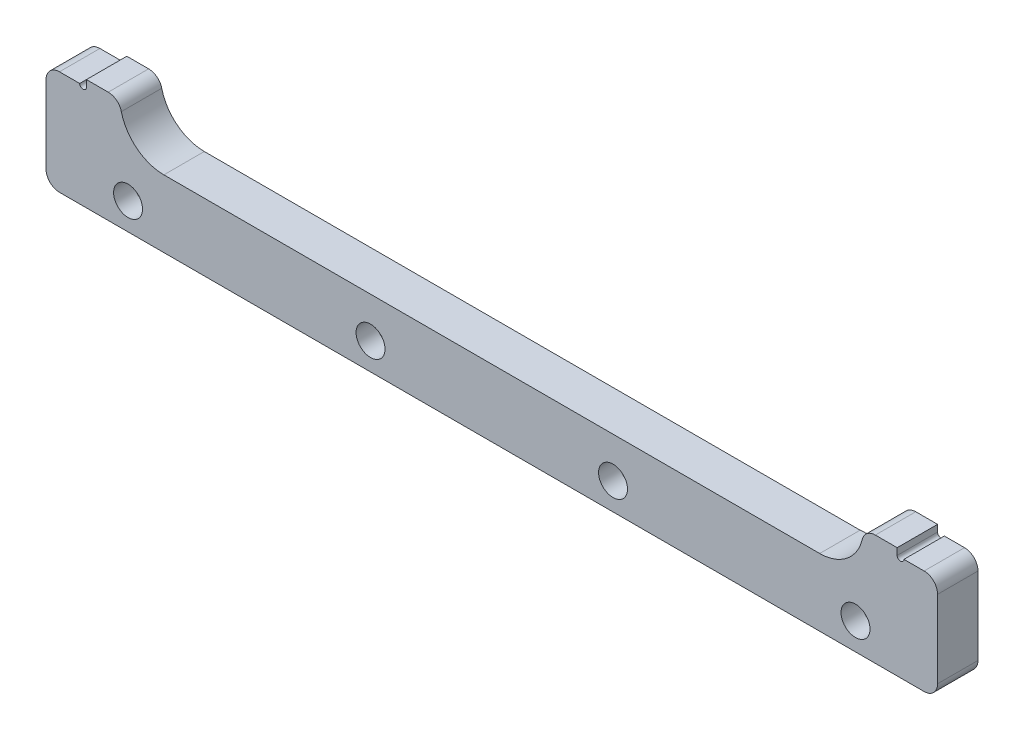
from build123d import *

# Parameters (mm, degrees)
EXTRUDE_1_DEPTH     = 6
CUT_EXTRUDE_START   = -6
CUT_EXTRUDE_1_DEPTH = 1
CUT_EXTRUDE_3_DEPTH = 3
SKETCH_5_OUTSIDE_W  = 281.366
SKETCH_5_OUTSIDE_H  = 83.498
CUT_EXTRUDE_2_DEPTH = 124.858535656
HOLE_WIZARD_M4_1_D  = 4.3
FILLET_3_R          = 2


with BuildPart() as part:
    # ｽｹｯﾁ1 → ﾎﾞｽ - 押し出し1 (new body)
    with BuildSketch(Plane.XY):
        with BuildLine():
            Line((-74.445215618, -8), (-65.183849372, -8))
            ThreePointArc((-65.183849372, -8), (-59.472431605, -21.788582233), (-45.683849372, -27.5))
            Line((-45.683849372, -27.5), (45.683849372, -27.5))
            ThreePointArc((45.683849372, -27.5), (59.472431605, -21.788582233), (65.183849372, -8))
            Line((65.183849372, -8), (74.445215618, -8))
            ThreePointArc((74.445215618, -8), (83.886790831, -21.023796042), (99.183849372, -26))
            Line((99.183849372, -26), (116.183849372, -26))
            Line((116.183849372, -26), (116.183849372, -34))
            Line((116.183849372, -34), (66.183849372, -42.5))
            Line((66.183849372, -42.5), (-66.183849372, -42.5))
            Line((-66.183849372, -42.5), (-116.183849372, -34))
            Line((-116.183849372, -34), (-116.183849372, -26))
            Line((-116.183849372, -26), (-99.183849372, -26))
            ThreePointArc((-99.183849372, -26), (-83.886790831, -21.023796042), (-74.445215618, -8))
        make_face()
    extrude(amount=-EXTRUDE_1_DEPTH)

    # ｽｹｯﾁ1<5> → ｶｯﾄ - 押し出し1 (cut)
    with BuildSketch(Plane.XY.offset(CUT_EXTRUDE_START)):
        with BuildLine():
            Line((-66.183849372, -8), (-72.183849372, -8))
            Line((-72.183849372, -8), (-72.183849372, -27))
            Line((-72.183849372, -27), (-116.183849372, -27))
            Line((-116.183849372, -27), (-116.183849372, -33))
            Line((-116.183849372, -33), (-72.183849372, -33))
            Line((-72.183849372, -33), (-72.183849372, -34))
            ThreePointArc((-72.183849372, -34), (-71.183849372, -35), (-70.183849372, -34))
            Line((-70.183849372, -34), (-68.183849372, -34))
            ThreePointArc((-68.183849372, -34), (-67.183849372, -35), (-66.183849372, -34))
            Line((-66.183849372, -34), (-66.183849372, -8))
        make_face()
        with BuildLine():
            Line((72.183849372, -8), (66.183849372, -8))
            Line((66.183849372, -8), (66.183849372, -34))
            ThreePointArc((66.183849372, -34), (67.183849372, -35), (68.183849372, -34))
            Line((68.183849372, -34), (70.183849372, -34))
            ThreePointArc((70.183849372, -34), (71.183849372, -35), (72.183849372, -34))
            Line((72.183849372, -34), (72.183849372, -33))
            Line((72.183849372, -33), (116.183849372, -33))
            Line((116.183849372, -33), (116.183849372, -27))
            Line((116.183849372, -27), (72.183849372, -27))
            Line((72.183849372, -27), (72.183849372, -8))
        make_face()
    extrude(amount=CUT_EXTRUDE_1_DEPTH, mode=Mode.SUBTRACT)

    # ｽｹｯﾁ1<6> → ｶｯﾄ - 押し出し3 (cut)
    with BuildSketch(Plane.XY.offset(CUT_EXTRUDE_START)):
        with BuildLine():
            Line((-58, -38.5), (-58, -42.5))
            Line((-58, -42.5), (-50, -42.5))
            Line((-50, -42.5), (-50, -38.5))
            ThreePointArc((-50, -38.5), (-54, -34.5), (-58, -38.5))
        make_face()
        with BuildLine():
            Line((-22, -38.5), (-22, -42.5))
            Line((-22, -42.5), (-14, -42.5))
            Line((-14, -42.5), (-14, -38.5))
            ThreePointArc((-14, -38.5), (-18, -34.5), (-22, -38.5))
        make_face()
        with BuildLine():
            Line((14, -38.5), (14, -42.5))
            Line((14, -42.5), (22, -42.5))
            Line((22, -42.5), (22, -38.5))
            ThreePointArc((22, -38.5), (18, -34.5), (14, -38.5))
        make_face()
        with BuildLine():
            Line((50, -38.5), (50, -42.5))
            Line((50, -42.5), (58, -42.5))
            Line((58, -42.5), (58, -38.5))
            ThreePointArc((58, -38.5), (54, -34.5), (50, -38.5))
        make_face()
    extrude(amount=CUT_EXTRUDE_3_DEPTH, mode=Mode.SUBTRACT)

    # ｽｹｯﾁ5 outside → ｶｯﾄ - 押し出し2 (cut, through all)
    with BuildSketch(Plane.XY):
        with Locations((0, -25.25)):
            Rectangle(SKETCH_5_OUTSIDE_W, SKETCH_5_OUTSIDE_H)
        with BuildLine():
            Line((-66.183849372, -27), (-61.183849372, -27))
            ThreePointArc((-61.183849372, -27), (-60.683849372, -27.5), (-60.183849372, -27))
            Line((-60.183849372, -27), (-60.183849372, -26))
            Line((-60.183849372, -26), (-55.183849372, -26))
            ThreePointArc((-55.183849372, -26), (-53.28004345, -30.596194078), (-48.683849372, -32.5))
            Line((-48.683849372, -32.5), (48.683849372, -32.5))
            ThreePointArc((48.683849372, -32.5), (53.28004345, -30.596194078), (55.183849372, -26))
            Line((55.183849372, -26), (60.183849372, -26))
            Line((60.183849372, -26), (60.183849372, -27))
            ThreePointArc((60.183849372, -27), (60.683849372, -27.5), (61.183849372, -27))
            Line((61.183849372, -27), (66.183849372, -27))
            Line((66.183849372, -27), (66.183849372, -42.5))
            Line((66.183849372, -42.5), (-66.183849372, -42.5))
            Line((-66.183849372, -42.5), (-66.183849372, -27))
        make_face(mode=Mode.SUBTRACT)
    extrude(amount=-CUT_EXTRUDE_2_DEPTH, mode=Mode.SUBTRACT)

    # M4 すきま穴1 (through all)
    with Locations(Plane(origin=(-54, -38.5, 0), x_dir=(1, 0, 0), z_dir=(0, 0, 1))):
        with Locations((0, 0), (36, 0), (72, 0), (108, 0)):
            Hole(HOLE_WIZARD_M4_1_D / 2)

    # ﾌｨﾚｯﾄ3
    fillet_3_edges = [part.edges().sort_by_distance(p)[0] for p in [
        (-58, -42.5, -4.5),
        (-50, -42.5, -4.5),
        (-22, -42.5, -4.5),
        (-14, -42.5, -4.5),
        (14, -42.5, -4.5),
        (22, -42.5, -4.5),
        (50, -42.5, -4.5),
        (58, -42.5, -4.5),
        (-66.183849372, -27, -3),
        (-55.183849372, -26, -3),
        (55.183849372, -26, -3),
        (66.183849372, -27, -3),
        (-66.183849372, -42.5, -3),
        (66.183849372, -42.5, -3),
    ]]
    fillet(fillet_3_edges, radius=FILLET_3_R)


solid = part.part
